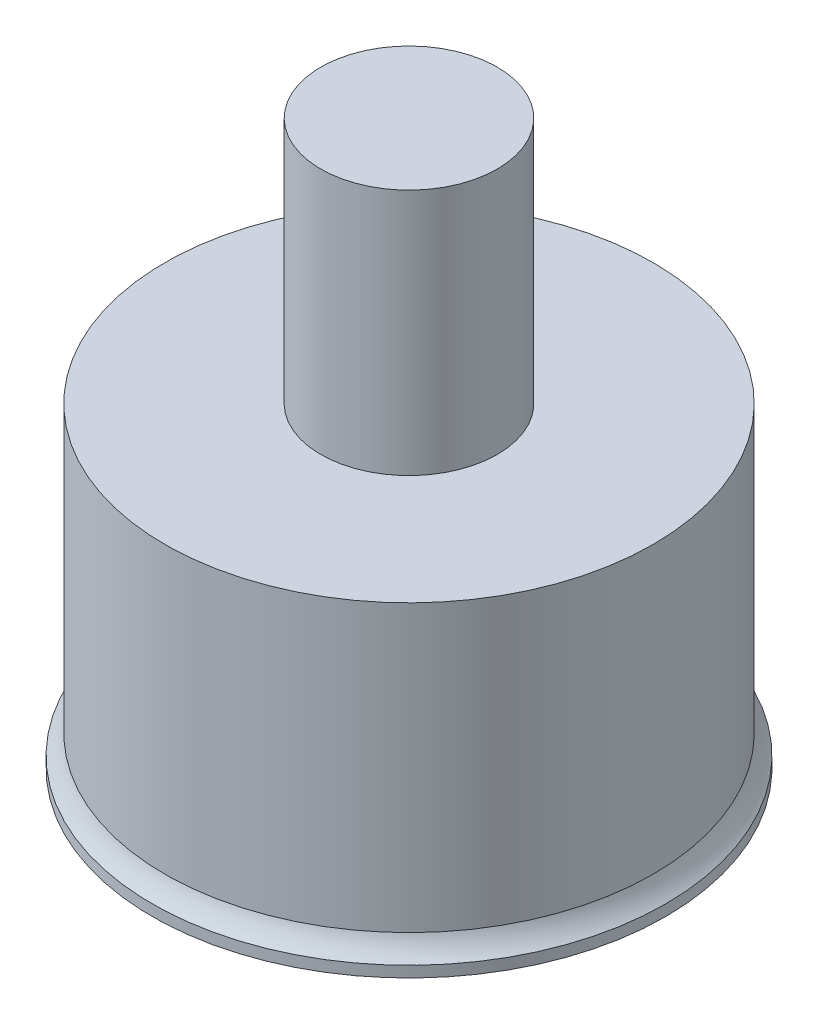
from build123d import *


with BuildPart() as part:
    # Sketch1 → Revolve1 (revolve)
    with BuildSketch(Plane.XY):
        with BuildLine():
            Line((29.07, 0), (29.07, 1.25))
            ThreePointArc((29.07, 1.25), (28.213426978, 2.255393777), (27.65, 3.45))
            Line((27.65, 3.45), (27.65, 35.8))
            Line((27.65, 35.8), (10, 35.8))
            Line((10, 35.8), (10, 63.8))
            Line((10, 63.8), (0, 63.8))
            Line((0, 63.8), (0, 0))
            Line((0, 0), (29.07, 0))
        make_face()
    revolve(axis=Axis((0, 0, 0), (0, 1, 0)))


solid = part.part
